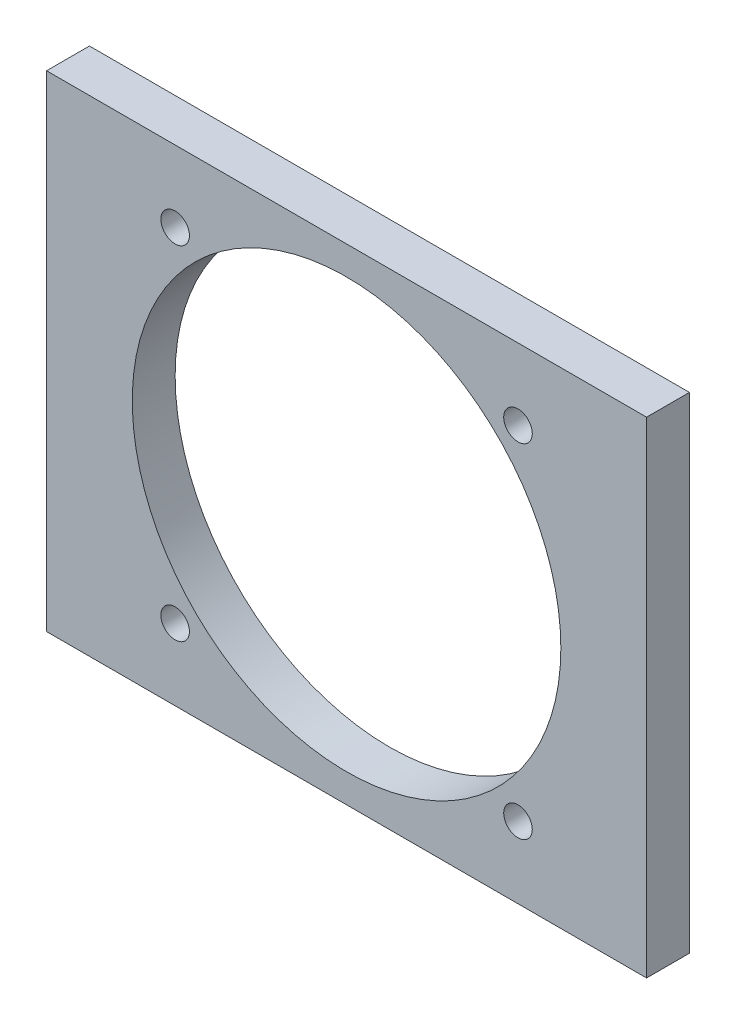
from build123d import *

# Parameters (mm, degrees)
SKETCH1_W           = 210
SKETCH1_H           = 170
BOSS_EXTRUDE1_DEPTH = 15
SKETCH2_R           = 75
SKETCH2_R_2         = 5
CUT_EXTRUDE1_DEPTH  = 15


with BuildPart() as part:
    # Sketch1 → Boss-Extrude1 (new body)
    with BuildSketch(Plane.XY):
        Rectangle(SKETCH1_W, SKETCH1_H)
    extrude(amount=BOSS_EXTRUDE1_DEPTH)

    # Sketch2 → Cut-Extrude1 (cut)
    with BuildSketch(Plane.XY.offset(15)):
        Circle(SKETCH2_R)
        with Locations((-60, 60)):
            Circle(SKETCH2_R_2)
        with Locations((60, 60)):
            Circle(SKETCH2_R_2)
        with Locations((60, -60)):
            Circle(SKETCH2_R_2)
        with Locations((-60, -60)):
            Circle(SKETCH2_R_2)
    extrude(amount=-CUT_EXTRUDE1_DEPTH, mode=Mode.SUBTRACT)


solid = part.part
